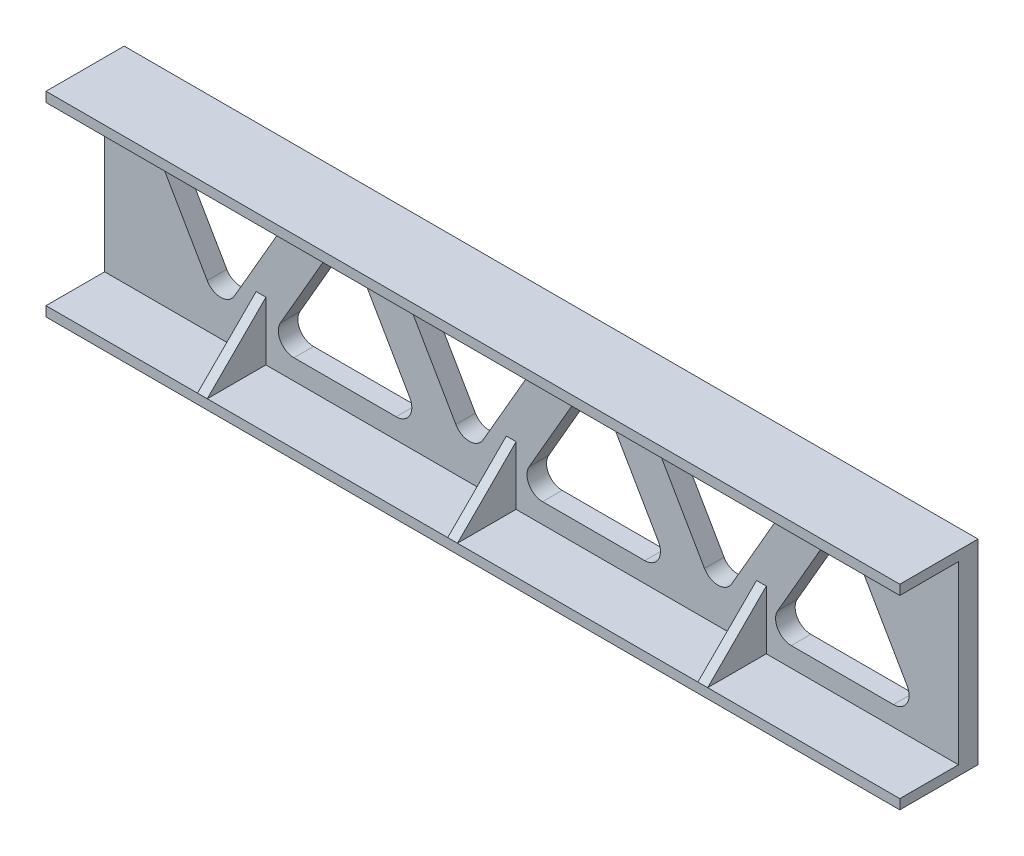
from build123d import *

# Parameters (mm, degrees)
BOSS_EXTRUDE1_DEPTH      = 6.35
FILLET1_R                = 5.08
SKETCH3_W                = 277.368
SKETCH3_H                = 25.4
BOSS_EXTRUDE2_DEPTH      = 3.175
SKETCH5_W                = 277.368
SKETCH5_H                = 25.4
BOSS_EXTRUDE3_DEPTH      = 3.175
BOSS_EXTRUDE4_DEPTH      = 1.5875
BOSS_EXTRUDE4_DEPTH_BACK = 1.5875
BOSS_EXTRUDE5_DEPTH      = 1.5875
BOSS_EXTRUDE5_DEPTH_BACK = 1.5875
BOSS_EXTRUDE6_DEPTH      = 1.5875
BOSS_EXTRUDE6_DEPTH_BACK = 1.5875
BOSS_EXTRUDE7_DEPTH      = 1.5875
BOSS_EXTRUDE7_DEPTH_BACK = 1.5875
BOSS_EXTRUDE8_DEPTH      = 1.5875
BOSS_EXTRUDE8_DEPTH_BACK = 1.5875
BOSS_EXTRUDE9_DEPTH      = 1.5875
BOSS_EXTRUDE9_DEPTH_BACK = 1.5875


with BuildPart() as part:
    # Sketch2 → Boss-Extrude1 (new body)
    with BuildSketch(Plane.XY):
        with BuildLine():
            Line((-5.12438972, 14.653837172), (267.16361028, 14.653837172))
            ThreePointArc((267.16361028, 14.653837172), (268.959661504, 15.397785947), (269.70361028, 17.193837172))
            Line((269.70361028, 17.193837172), (269.70361028, 75.613837172))
            ThreePointArc((269.70361028, 75.613837172), (268.959661504, 77.409888396), (267.16361028, 78.153837172))
            Line((267.16361028, 78.153837172), (-5.12438972, 78.153837172))
            ThreePointArc((-5.12438972, 78.153837172), (-6.920440944, 77.409888396), (-7.66438972, 75.613837172))
            Line((-7.66438972, 75.613837172), (-7.66438972, 17.193837172))
            ThreePointArc((-7.66438972, 17.193837172), (-6.920440944, 15.397785947), (-5.12438972, 14.653837172))
        make_face()
        Polygon((30.05461028, 24.406794359), (4.65461028, 68.400884872), (55.45461028, 68.400884872), align=None, mode=Mode.SUBTRACT)
        Polygon((70.44061028, 68.400882428), (95.84061028, 24.406791915), (45.04061028, 24.406791915), align=None, mode=Mode.SUBTRACT)
        Polygon((110.82627023, 24.305837172), (85.42627023, 68.299927684), (136.22627023, 68.299927684), align=None, mode=Mode.SUBTRACT)
        Polygon((125.81227023, 24.305834728), (151.21227023, 68.29992524), (176.61227023, 24.305834728), align=None, mode=Mode.SUBTRACT)
        Polygon((191.59793018, 24.204879984), (166.19793018, 68.198970496), (216.99793018, 68.198970496), align=None, mode=Mode.SUBTRACT)
        Polygon((206.58393018, 24.20487754), (231.98393018, 68.198968052), (257.38393018, 24.20487754), align=None, mode=Mode.SUBTRACT)
    extrude(amount=BOSS_EXTRUDE1_DEPTH)

    # Fillet1
    fillet1_edges = [part.edges().sort_by_distance(p)[0] for p in [
        (257.38393018, 24.20487754, 3.175),
        (231.98393018, 68.198968052, 3.175),
        (206.58393018, 24.20487754, 3.175),
        (176.61227023, 24.305834728, 3.175),
        (151.21227023, 68.29992524, 3.175),
        (125.81227023, 24.305834728, 3.175),
        (4.65461028, 68.400884872, 3.175),
        (30.05461028, 24.406794359, 3.175),
        (55.45461028, 68.400884872, 3.175),
        (95.84061028, 24.406791915, 3.175),
        (70.44061028, 68.400882428, 3.175),
        (45.04061028, 24.406791915, 3.175),
        (85.42627023, 68.299927684, 3.175),
        (110.82627023, 24.305837172, 3.175),
        (136.22627023, 68.299927684, 3.175),
        (166.19793018, 68.198970496, 3.175),
        (191.59793018, 24.204879984, 3.175),
        (216.99793018, 68.198970496, 3.175),
    ]]
    fillet(fillet1_edges, radius=FILLET1_R)

    # Sketch3 → Boss-Extrude2 (add)
    with BuildSketch(Plane(origin=(0, 78.153837172, 0), x_dir=(1, 0, 0), z_dir=(0, 1, 0))):
        with Locations((131.01961028, -12.7)):
            Rectangle(SKETCH3_W, SKETCH3_H)
    extrude(amount=-BOSS_EXTRUDE2_DEPTH)

    # Sketch5 → Boss-Extrude3 (add)
    with BuildSketch(Plane(origin=(0, 14.653837172, 0), x_dir=(-1, 0, 0), z_dir=(0, -1, 0))):
        with Locations((-131.01961028, -12.7)):
            Rectangle(SKETCH5_W, SKETCH5_H)
    extrude(amount=-BOSS_EXTRUDE3_DEPTH)

    # Sketch8 → Boss-Extrude4 (add, two sides: drawn at the far end of the back side and taken through both)
    with BuildSketch(Plane(origin=(43.13561028, 0, 0), x_dir=(0, 0, -1), z_dir=(1, 0, 0)).offset(-BOSS_EXTRUDE4_DEPTH_BACK)):
        Polygon((-25.4, 17.828837172), (-6.35, 17.828837172), (-6.35, 36.878837172), align=None)
    extrude(amount=BOSS_EXTRUDE4_DEPTH + BOSS_EXTRUDE4_DEPTH_BACK)

    # Sketch9 → Boss-Extrude5 (add, two sides: drawn at the far end of the back side and taken through both)
    with BuildSketch(Plane(origin=(124.41561028, 0, 0), x_dir=(0, 0, -1), z_dir=(1, 0, 0)).offset(-BOSS_EXTRUDE5_DEPTH_BACK)):
        Polygon((-25.4, 17.828837172), (-6.35, 17.828837172), (-6.35, 36.878837172), align=None)
    extrude(amount=BOSS_EXTRUDE5_DEPTH + BOSS_EXTRUDE5_DEPTH_BACK)

    # Sketch10 → Boss-Extrude6 (add, two sides: drawn at the far end of the back side and taken through both)
    with BuildSketch(Plane(origin=(205.69561028, 0, 0), x_dir=(0, 0, -1), z_dir=(1, 0, 0)).offset(-BOSS_EXTRUDE6_DEPTH_BACK)):
        Polygon((-25.4, 17.828837172), (-6.35, 17.828837172), (-6.35, 36.878837172), align=None)
    extrude(amount=BOSS_EXTRUDE6_DEPTH + BOSS_EXTRUDE6_DEPTH_BACK)

    # Sketch11 → Boss-Extrude7 (add, two sides: drawn at the far end of the back side and taken through both)
    with BuildSketch(Plane.ZY.offset(-218.133612998).offset(-BOSS_EXTRUDE7_DEPTH_BACK)):
        Polygon((25.4, 74.978837172), (6.35, 74.978837172), (6.35, 55.928837172), align=None)
    extrude(amount=BOSS_EXTRUDE7_DEPTH + BOSS_EXTRUDE7_DEPTH_BACK)

    # Sketch12 → Boss-Extrude8 (add, two sides: drawn at the far end of the back side and taken through both)
    with BuildSketch(Plane.ZY.offset(-135.652884913).offset(-BOSS_EXTRUDE8_DEPTH_BACK)):
        Polygon((25.4, 74.978837172), (6.35, 74.978837172), (6.35, 55.928837172), align=None)
    extrude(amount=BOSS_EXTRUDE8_DEPTH + BOSS_EXTRUDE8_DEPTH_BACK)

    # Sketch13 → Boss-Extrude9 (add, two sides: drawn at the far end of the back side and taken through both)
    with BuildSketch(Plane.ZY.offset(-54.372884913).offset(-BOSS_EXTRUDE9_DEPTH_BACK)):
        Polygon((25.4, 74.978837172), (6.35, 74.978837172), (6.35, 55.928837172), align=None)
    extrude(amount=BOSS_EXTRUDE9_DEPTH + BOSS_EXTRUDE9_DEPTH_BACK)


solid = part.part
